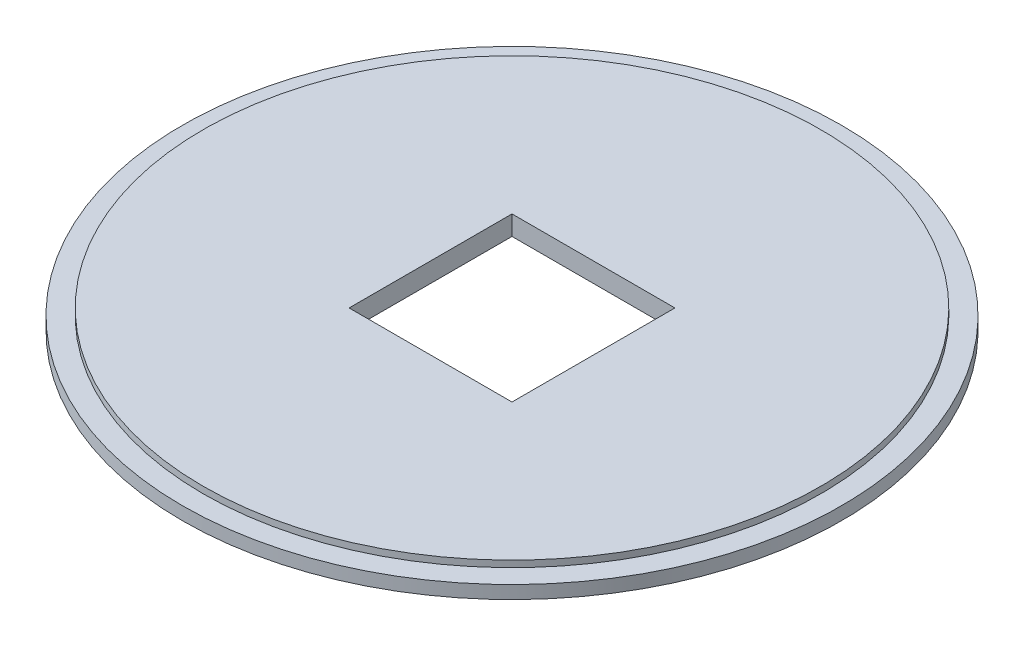
from build123d import *

# Parameters (mm, degrees)
SKETCH2_W          = 50
SKETCH2_H          = 50
CUT_EXTRUDE1_DEPTH = 10


with BuildPart() as part:
    # Sketch1 → Revolve1 (revolve)
    with BuildSketch(Plane.XY, mode=Mode.PRIVATE) as revolve1_sk:
        Polygon((0, 0), (-101.15, 0), (-101.15, 4), (-94.8, 4), (-94.8, 6), (0, 6), align=None)
    revolve(revolve1_sk.sketch.rotate(Axis((0, 6, 0), (0, -1, 0)), 270), axis=Axis((0, 6, 0), (0, -1, 0)))

    # Sketch2 → Cut-Extrude1 (cut)
    with BuildSketch(Plane(origin=(0, 0, 0), x_dir=(1, 0, 0), z_dir=(0, 1, 0))):
        Rectangle(SKETCH2_W, SKETCH2_H)
    extrude(amount=CUT_EXTRUDE1_DEPTH, mode=Mode.SUBTRACT)


solid = part.part
